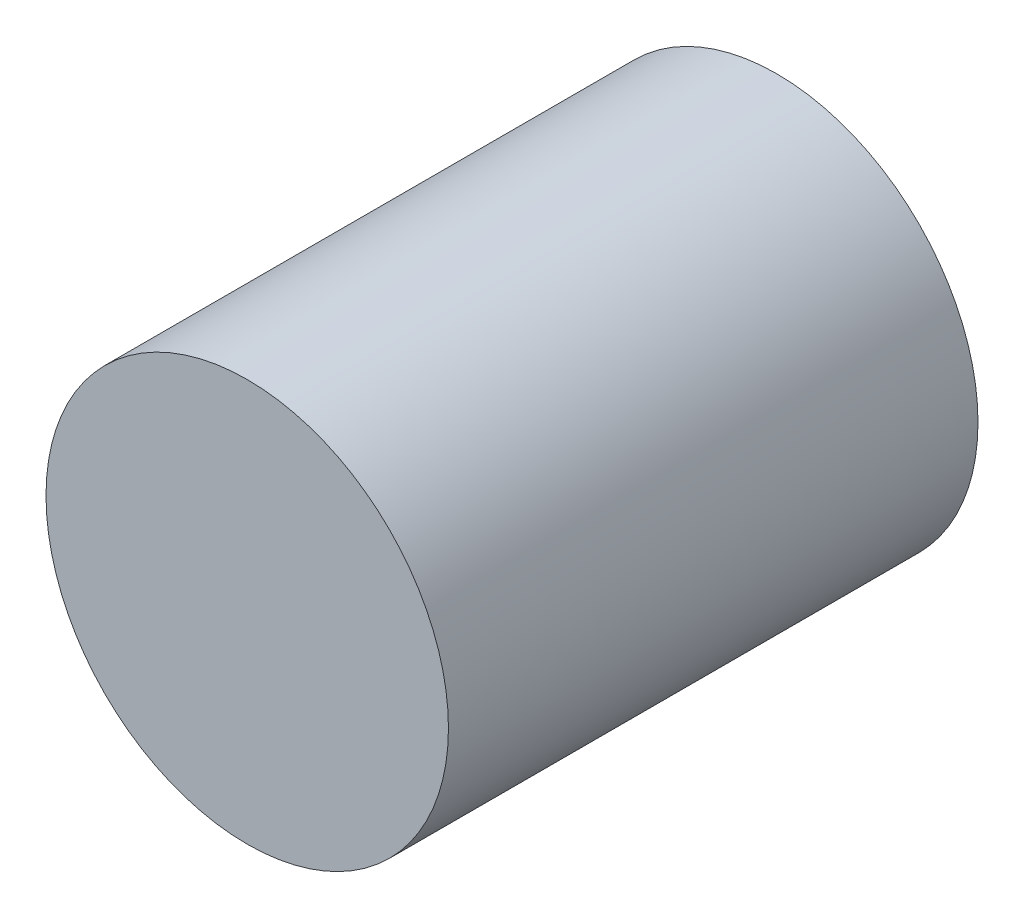
from build123d import *

# Parameters (mm, degrees)
SKETCH1_R           = 4.826
BOSS_EXTRUDE1_DEPTH = 12.7


with BuildPart() as part:
    # Sketch1 → Boss-Extrude1 (new body)
    with BuildSketch(Plane.XY):
        Circle(SKETCH1_R)
    extrude(amount=BOSS_EXTRUDE1_DEPTH)


solid = part.part
